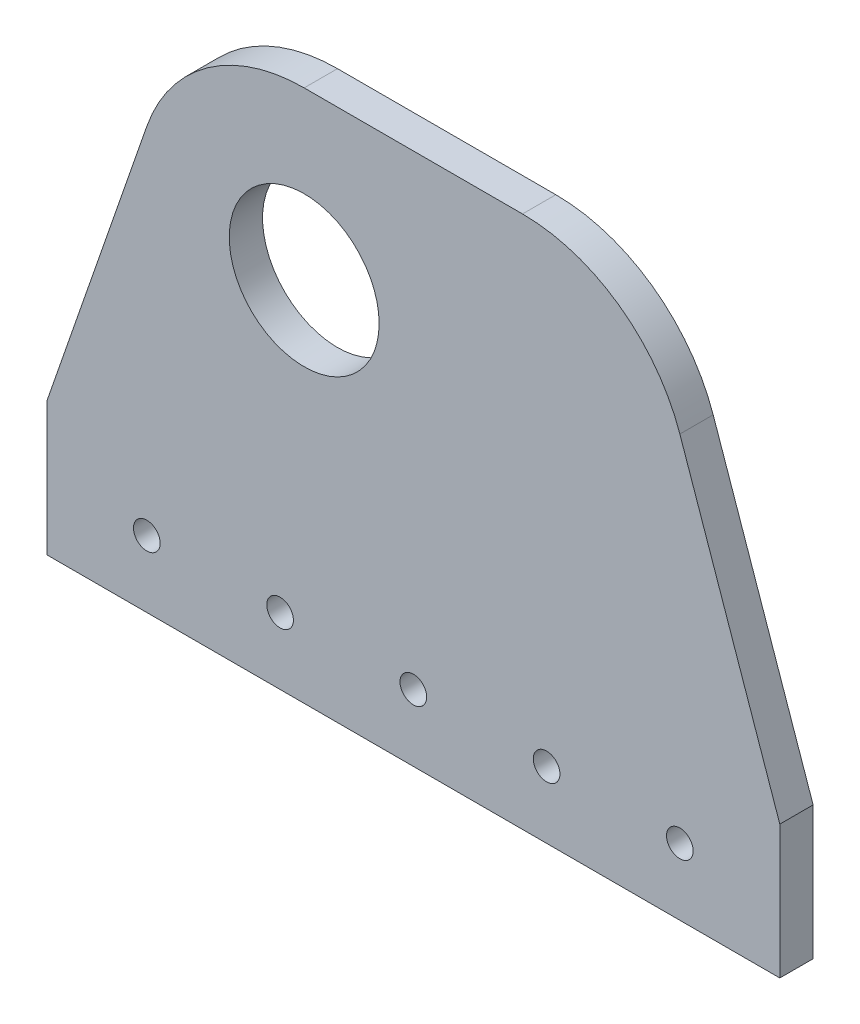
from build123d import *

# Parameters (mm, degrees)
SKETCH1_R           = 14.2875
SKETCH1_R_2         = 2.54
BOSS_EXTRUDE1_DEPTH = 6.35


with BuildPart() as part:
    # Sketch1 → Boss-Extrude1 (new body)
    with BuildSketch(Plane.XY):
        with BuildLine():
            Line((49.043407506, 101.6), (90.656592494, 101.6))
            ThreePointArc((90.656592494, 101.6), (109.060504085, 95.721964327), (120.65, 80.264317364))
            Line((120.65, 80.264317364), (139.7, 25.4))
            Line((139.7, 25.4), (139.7, 0))
            Line((139.7, 0), (0, 0))
            Line((0, 0), (0, 25.4))
            Line((0, 25.4), (19.05, 80.264317364))
            ThreePointArc((19.05, 80.264317364), (30.639495915, 95.721964327), (49.043407506, 101.6))
        make_face()
        with Locations((49.043407506, 69.85)):
            Circle(SKETCH1_R, mode=Mode.SUBTRACT)
        with Locations((69.85, 12.7)):
            Circle(SKETCH1_R_2, mode=Mode.SUBTRACT)
        with Locations((95.25, 12.7)):
            Circle(SKETCH1_R_2, mode=Mode.SUBTRACT)
        with Locations((120.65, 12.7)):
            Circle(SKETCH1_R_2, mode=Mode.SUBTRACT)
        with Locations((44.45, 12.7)):
            Circle(SKETCH1_R_2, mode=Mode.SUBTRACT)
        with Locations((19.05, 12.7)):
            Circle(SKETCH1_R_2, mode=Mode.SUBTRACT)
    extrude(amount=BOSS_EXTRUDE1_DEPTH)


solid = part.part
